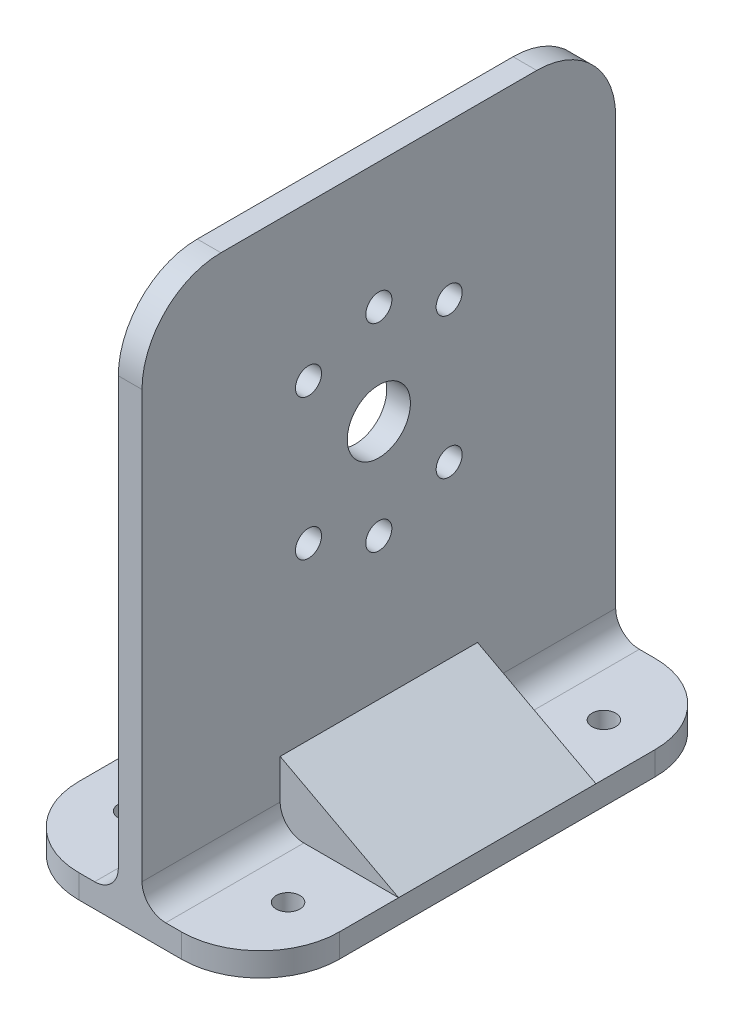
from build123d import *

# Parameters (mm, degrees)
SKETCH_1_W               = 3
SKETCH_1_H               = 70
EXTRUDE_1_DEPTH          = 60
SKETCH_2_W               = 60
SKETCH_2_H               = 3
EXTRUDE_2_DEPTH          = 15
FILLET_2_R               = 10
CUT_EXTRUDE_1_REACH      = 73.757
SKETCH_3_R               = 1.65
SKETCH_3_R_2             = 4
SKETCH_5_R               = 1.5
CUT_EXTRUDE_4_DEPTH      = 3
FILLET_3_R               = 10
MIRROR_3_COPY_1_SKETCH_R = 1.5
MIRROR_3_COPY_1_DEPTH    = 3
MIRROR_3_COPY_2_SKETCH_R = 1.5
MIRROR_3_COPY_2_DEPTH    = 3
SKETCH_7_R               = 1.65
CUT_EXTRUDE_5_DEPTH      = 10
EXTRUDE_3_DEPTH          = 12.5
FILLET_4_R               = 3


with BuildPart() as part:
    # 草图1 → 凸台-拉伸1 (new body)
    with BuildSketch(Plane.XY):
        Rectangle(SKETCH_1_W, SKETCH_1_H)
    extrude(amount=EXTRUDE_1_DEPTH)

    # 草图2 → 凸台-拉伸2 (add)
    with BuildSketch(Plane.ZY.offset(1.5)):
        with Locations((30, -33.5)):
            Rectangle(SKETCH_2_W, SKETCH_2_H)
    extrude_2 = extrude(amount=EXTRUDE_2_DEPTH)

    # 镜向1: 凸台-拉伸2 across plane
    add(extrude_2.mirror(Plane(origin=(0, 0, 0), x_dir=(0, 0, 1), z_dir=(1, 0, 0))))

    # 圆角2
    fillet_2_edges = [part.edges().sort_by_distance(p)[0] for p in [
        (0, 35, 0),
        (0, 35, 60),
    ]]
    fillet(fillet_2_edges, radius=FILLET_2_R)

    # 草图3 → 切除-拉伸1 (cut, up to next)
    with BuildSketch(Plane(origin=(1.5, 0, 0), x_dir=(0, 0, -1), z_dir=(1, 0, 0)), mode=Mode.PRIVATE) as cut_extrude_1_sk1:
        with Locations((-38.909545443, -2.409545443)):
            Circle(SKETCH_3_R)
    cut_extrude_1_tool1 = extrude(cut_extrude_1_sk1.sketch, amount=-CUT_EXTRUDE_1_REACH, mode=Mode.PRIVATE) & part.part
    # 草图3 → 切除-拉伸1 (cut, up to next)
    with BuildSketch(Plane(origin=(1.5, 0, 0), x_dir=(0, 0, -1), z_dir=(1, 0, 0)), mode=Mode.PRIVATE) as cut_extrude_1_sk2:
        with Locations((-21.090454557, -2.409545443)):
            Circle(SKETCH_3_R)
    cut_extrude_1_tool2 = extrude(cut_extrude_1_sk2.sketch, amount=-CUT_EXTRUDE_1_REACH, mode=Mode.PRIVATE) & part.part
    # 草图3 → 切除-拉伸1 (cut, up to next)
    with BuildSketch(Plane(origin=(1.5, 0, 0), x_dir=(0, 0, -1), z_dir=(1, 0, 0)), mode=Mode.PRIVATE) as cut_extrude_1_sk3:
        with Locations((-30, 6.5)):
            Circle(SKETCH_3_R_2)
    cut_extrude_1_tool3 = extrude(cut_extrude_1_sk3.sketch, amount=-CUT_EXTRUDE_1_REACH, mode=Mode.PRIVATE) & part.part
    # 草图3 → 切除-拉伸1 (cut, up to next)
    with BuildSketch(Plane(origin=(1.5, 0, 0), x_dir=(0, 0, -1), z_dir=(1, 0, 0)), mode=Mode.PRIVATE) as cut_extrude_1_sk4:
        with Locations((-38.909545443, 15.409545443)):
            Circle(SKETCH_3_R)
    cut_extrude_1_tool4 = extrude(cut_extrude_1_sk4.sketch, amount=-CUT_EXTRUDE_1_REACH, mode=Mode.PRIVATE) & part.part
    # 草图3 → 切除-拉伸1 (cut, up to next)
    with BuildSketch(Plane(origin=(1.5, 0, 0), x_dir=(0, 0, -1), z_dir=(1, 0, 0)), mode=Mode.PRIVATE) as cut_extrude_1_sk5:
        with Locations((-21.090454557, 15.409545443)):
            Circle(SKETCH_3_R)
    cut_extrude_1_tool5 = extrude(cut_extrude_1_sk5.sketch, amount=-CUT_EXTRUDE_1_REACH, mode=Mode.PRIVATE) & part.part
    add(cut_extrude_1_tool1.solids().sort_by_distance((1.5, -2.409545, 38.909545))[0], mode=Mode.SUBTRACT)
    add(cut_extrude_1_tool2.solids().sort_by_distance((1.5, -2.409545, 21.090455))[0], mode=Mode.SUBTRACT)
    add(cut_extrude_1_tool3.solids().sort_by_distance((1.5, 6.5, 30))[0], mode=Mode.SUBTRACT)
    add(cut_extrude_1_tool4.solids().sort_by_distance((1.5, 15.409545, 38.909545))[0], mode=Mode.SUBTRACT)
    add(cut_extrude_1_tool5.solids().sort_by_distance((1.5, 15.409545, 21.090455))[0], mode=Mode.SUBTRACT)

    # 草图5 → 切除-拉伸4 (cut)
    with BuildSketch(Plane(origin=(0, -35, 0), x_dir=(1, 0, 0), z_dir=(0, 1, 0))):
        with Locations(Location((10, -10, 0), (0, 0, 270))):
            Circle(SKETCH_5_R)
    cut_extrude_4 = extrude(amount=CUT_EXTRUDE_4_DEPTH, mode=Mode.SUBTRACT)

    # 圆角3
    fillet_3_edges = [part.edges().sort_by_distance(p)[0] for p in [
        (-16.5, -33.5, 0),
        (-16.5, -33.5, 60),
        (16.5, -33.5, 60),
        (16.5, -33.5, 0),
    ]]
    fillet(fillet_3_edges, radius=FILLET_3_R)

    # 镜向2: 切除-拉伸4 across plane
    add(cut_extrude_4.mirror(Plane(origin=(0, 0, 0), x_dir=(0, 0, 1), z_dir=(1, 0, 0))), mode=Mode.SUBTRACT)

    # 镜向2 at the second plane: 切除-拉伸4 across plane
    add(cut_extrude_4.mirror(Plane.ZX), mode=Mode.SUBTRACT)

    # 镜向3: 切除-拉伸4 across plane
    add(cut_extrude_4.mirror(Plane.XY.offset(30)), mode=Mode.SUBTRACT)

    # 镜向3 copy 1 sketch → 镜向3 copy 1 (cut)
    with BuildSketch(Plane(origin=(0, -35, 60), x_dir=(-1, 0, 0), z_dir=(0, 1, 0))):
        with Locations(Location((10, -10, 0), (0, 0, 270))):
            Circle(MIRROR_3_COPY_1_SKETCH_R)
    extrude(amount=MIRROR_3_COPY_1_DEPTH, mode=Mode.SUBTRACT)

    # 镜向3 copy 2 sketch → 镜向3 copy 2 (cut)
    with BuildSketch(Plane(origin=(0, 35, 60), x_dir=(1, 0, 0), z_dir=(0, -1, 0))):
        with Locations(Location((10, -10, 0), (0, 0, 270))):
            Circle(MIRROR_3_COPY_2_SKETCH_R)
    extrude(amount=MIRROR_3_COPY_2_DEPTH, mode=Mode.SUBTRACT)

    # 草图7 → 切除-拉伸5 (cut)
    with BuildSketch(Plane.ZY.offset(1.5)):
        with Locations((30, 19.05)):
            Circle(SKETCH_7_R)
        with Locations((30, -6.05)):
            Circle(SKETCH_7_R)
    extrude(amount=-CUT_EXTRUDE_5_DEPTH, mode=Mode.SUBTRACT)

    # 草图8 → 凸台-拉伸3 (add, symmetric)
    with BuildSketch(Plane.XY.offset(30)):
        Polygon((1.5, -24), (16.5, -32), (1.5, -32), align=None)
    extrude_3 = extrude(amount=EXTRUDE_3_DEPTH, both=True)

    # 镜向4: 凸台-拉伸3 across plane
    add(extrude_3.mirror(Plane(origin=(0, 0, 0), x_dir=(0, 0, 1), z_dir=(1, 0, 0))))

    # 圆角4
    fillet_4_edges = [part.edges().sort_by_distance(p)[0] for p in [
        (1.5, -32, 51.25),
        (-1.5, -32, 51.25),
        (-1.5, -32, 8.75),
        (1.5, -32, 8.75),
    ]]
    fillet(fillet_4_edges, radius=FILLET_4_R)


solid = part.part
